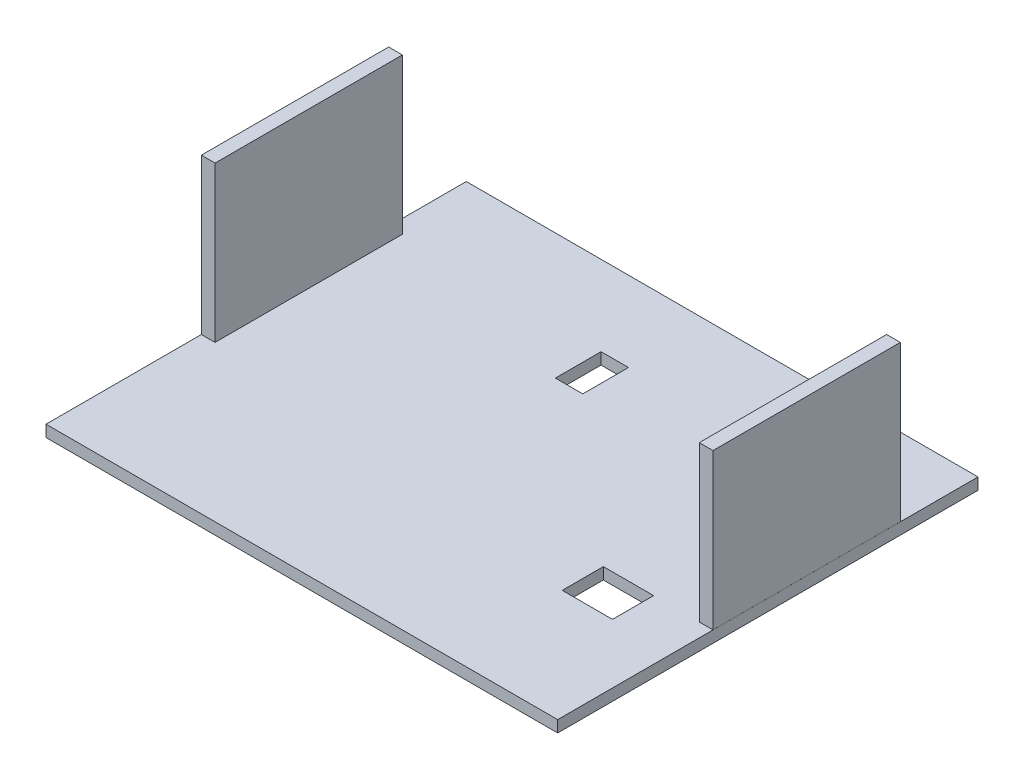
from build123d import *

# Parameters (mm, degrees)
SKETCH1_W           = 56
SKETCH1_H           = 46
BOSS_EXTRUDE1_DEPTH = 1.27
SKETCH2_W           = 1.5
SKETCH2_H           = 20.5
BOSS_EXTRUDE2_DEPTH = 17
SKETCH3_W           = 3
SKETCH3_H           = 5
CUT_EXTRUDE1_DEPTH  = 17
SKETCH4_W           = 5.5
SKETCH4_H           = 4.5
CUT_EXTRUDE2_DEPTH  = 17


with BuildPart() as part:
    # Sketch1 → Boss-Extrude1 (new body)
    with BuildSketch(Plane(origin=(0, 0, 0), x_dir=(1, 0, 0), z_dir=(0, 1, 0))):
        Rectangle(SKETCH1_W, SKETCH1_H)
    extrude(amount=BOSS_EXTRUDE1_DEPTH)

    # Sketch2 → Boss-Extrude2 (add)
    with BuildSketch(Plane(origin=(0, 1.27, 0), x_dir=(1, 0, 0), z_dir=(0, 1, 0))):
        with Locations((-27.248, 4.25)):
            Rectangle(SKETCH2_W, SKETCH2_H)
    boss_extrude2 = extrude(amount=BOSS_EXTRUDE2_DEPTH)

    # Mirror2: Boss-Extrude2 across plane
    add(boss_extrude2.mirror(Plane(origin=(0, 0, 0), x_dir=(0, 0, 1), z_dir=(1, 0, 0))))

    # Sketch3 → Cut-Extrude1 (cut)
    with BuildSketch(Plane(origin=(0, 1.27, 0), x_dir=(1, 0, 0), z_dir=(0, 1, 0))):
        with Locations((-2.998, 11.743007137)):
            Rectangle(SKETCH3_W, SKETCH3_H)
    extrude(amount=-CUT_EXTRUDE1_DEPTH, mode=Mode.SUBTRACT)

    # Sketch4 → Cut-Extrude2 (cut)
    with BuildSketch(Plane(origin=(0, 1.27, 0), x_dir=(1, 0, 0), z_dir=(0, 1, 0))):
        with Locations((18.748, -8.25)):
            Rectangle(SKETCH4_W, SKETCH4_H)
    extrude(amount=-CUT_EXTRUDE2_DEPTH, mode=Mode.SUBTRACT)


solid = part.part
